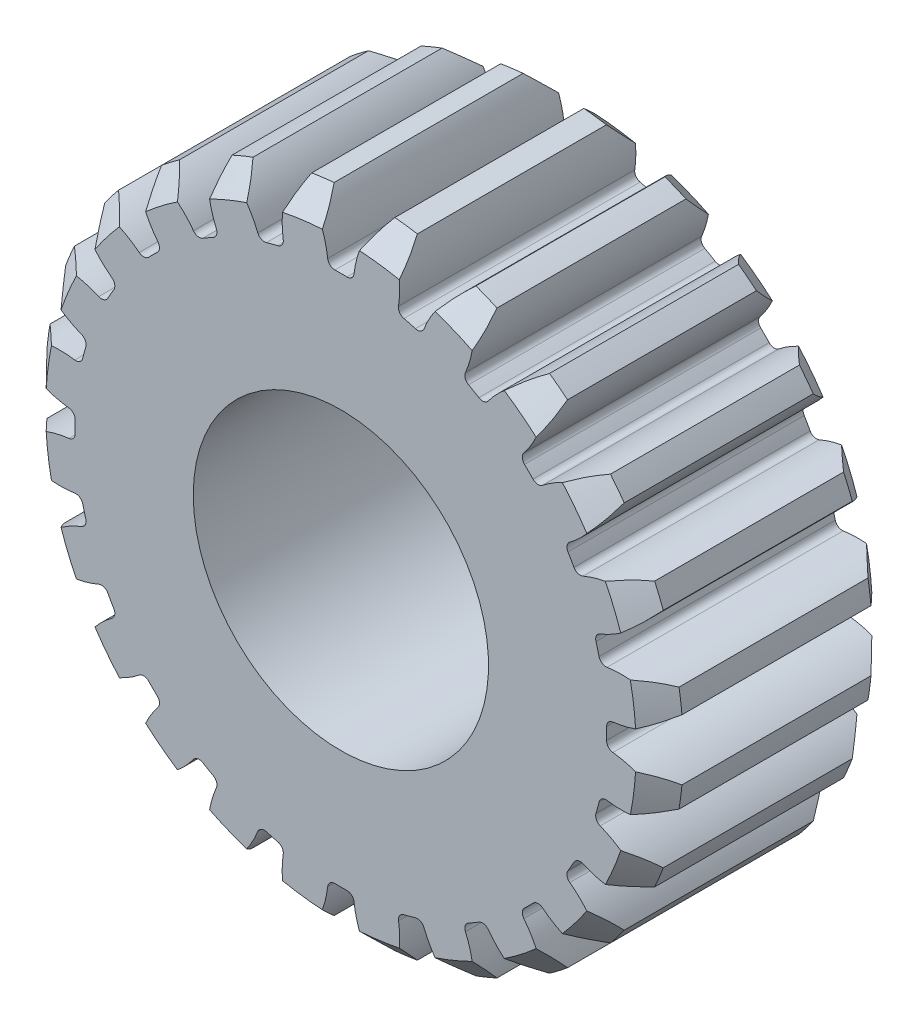
from build123d import *

# Parameters (mm, degrees)
SKETCH1_R                = 27
BOSS_EXTRUDE1_DEPTH      = 10
CUT_EXTRUDE4_DEPTH       = 40.471508712
FILLET1_R                = 0.6
CHAMFER1_SIZE            = 2
CIRPATTERN1_COUNT        = 24
FILLET1_OF_CIRPATTERN1_R = 0.6
SKETCH3_R                = 12.5
CUT_EXTRUDE6_DEPTH       = 43.951130564


with BuildPart() as part:
    # Sketch1 → Boss-Extrude1 (new, symmetric)
    with BuildSketch(Plane.XY):
        Circle(SKETCH1_R)
    extrude(amount=BOSS_EXTRUDE1_DEPTH, both=True)

    # Sketch2 → Cut-Extrude4 (cut, symmetric)
    with BuildSketch(Plane.XY):
        with BuildLine():
            ThreePointArc((1.072022538, 22.474446994), (0, 22.5), (-1.072022538, 22.474446994))
            ThreePointArc((-1.072022538, 22.474446994), (-1.510220721, 24.781486697), (-2.569085244, 26.877496182))
            ThreePointArc((-2.569085244, 26.877496182), (0, 27), (2.569085244, 26.877496182))
            ThreePointArc((2.569085244, 26.877496182), (1.510220721, 24.781486697), (1.072022538, 22.474446994))
        make_face()
    cut_extrude4 = extrude(amount=CUT_EXTRUDE4_DEPTH, both=True, mode=Mode.SUBTRACT)

    # Fillet1
    fillet1_edges = [part.edges().sort_by_distance(p)[0] for p in [
        (1.072022538, 22.474446994, 0),
        (-1.072022538, 22.474446994, 0),
    ]]
    fillet(fillet1_edges, radius=FILLET1_R)

    # Chamfer1
    chamfer1_edges = [part.edges().sort_by_distance(p)[0] for p in [
        (0, -27, -10),
        (0, -27, 10),
    ]]
    chamfer(chamfer1_edges, length=CHAMFER1_SIZE)

    # CirPattern1: Cut-Extrude4 ×24 about axis
    cirpattern1_axis = Axis((0, 0, 0), (0, 0, 1))
    for i in range(1, CIRPATTERN1_COUNT):
        add(cut_extrude4.rotate(cirpattern1_axis, i * 360 / CIRPATTERN1_COUNT), mode=Mode.SUBTRACT)

    # Fillet1 of CirPattern1
    fillet1_of_cirpattern1_edges = [part.edges().sort_by_distance(p)[0] for p in [
        (-4.781320654, 21.986108632, 0),
        (-6.852309166, 21.431188933, 0),
        (-10.308824746, 19.999453302, 0),
        (-12.165622248, 18.927430764, 0),
        (-15.133799467, 16.649868279, 0),
        (-16.649868279, 15.133799467, 0),
        (-18.927430764, 12.165622248, 0),
        (-19.999453302, 10.308824746, 0),
        (-21.431188933, 6.852309166, 0),
        (-21.986108632, 4.781320654, 0),
        (-22.474446994, 1.072022538, 0),
        (-22.474446994, -1.072022538, 0),
        (-21.986108632, -4.781320654, 0),
        (-21.431188933, -6.852309166, 0),
        (-19.999453302, -10.308824746, 0),
        (-18.927430764, -12.165622248, 0),
        (-16.649868279, -15.133799467, 0),
        (-15.133799467, -16.649868279, 0),
        (-12.165622248, -18.927430764, 0),
        (-10.308824746, -19.999453302, 0),
        (-6.852309166, -21.431188933, 0),
        (-4.781320654, -21.986108632, 0),
        (-1.072022538, -22.474446994, 0),
        (1.072022538, -22.474446994, 0),
        (4.781320654, -21.986108632, 0),
        (6.852309166, -21.431188933, 0),
        (10.308824746, -19.999453302, 0),
        (12.165622248, -18.927430764, 0),
        (15.133799467, -16.649868279, 0),
        (16.649868279, -15.133799467, 0),
        (18.927430764, -12.165622248, 0),
        (19.999453302, -10.308824746, 0),
        (21.431188933, -6.852309166, 0),
        (21.986108632, -4.781320654, 0),
        (22.474446994, -1.072022538, 0),
        (22.474446994, 1.072022538, 0),
        (21.986108632, 4.781320654, 0),
        (21.431188933, 6.852309166, 0),
        (19.999453302, 10.308824746, 0),
        (18.927430764, 12.165622248, 0),
        (16.649868279, 15.133799467, 0),
        (15.133799467, 16.649868279, 0),
        (12.165622248, 18.927430764, 0),
        (10.308824746, 19.999453302, 0),
        (6.852309166, 21.431188933, 0),
        (4.781320654, 21.986108632, 0),
    ]]
    fillet(fillet1_of_cirpattern1_edges, radius=FILLET1_OF_CIRPATTERN1_R)

    # Sketch3 → Cut-Extrude6 (cut, through all)
    with BuildSketch(Plane(origin=(0, 0, -10), x_dir=(-1, 0, 0), z_dir=(0, 0, -1))):
        Circle(SKETCH3_R)
    extrude(amount=-CUT_EXTRUDE6_DEPTH, mode=Mode.SUBTRACT)


solid = part.part
